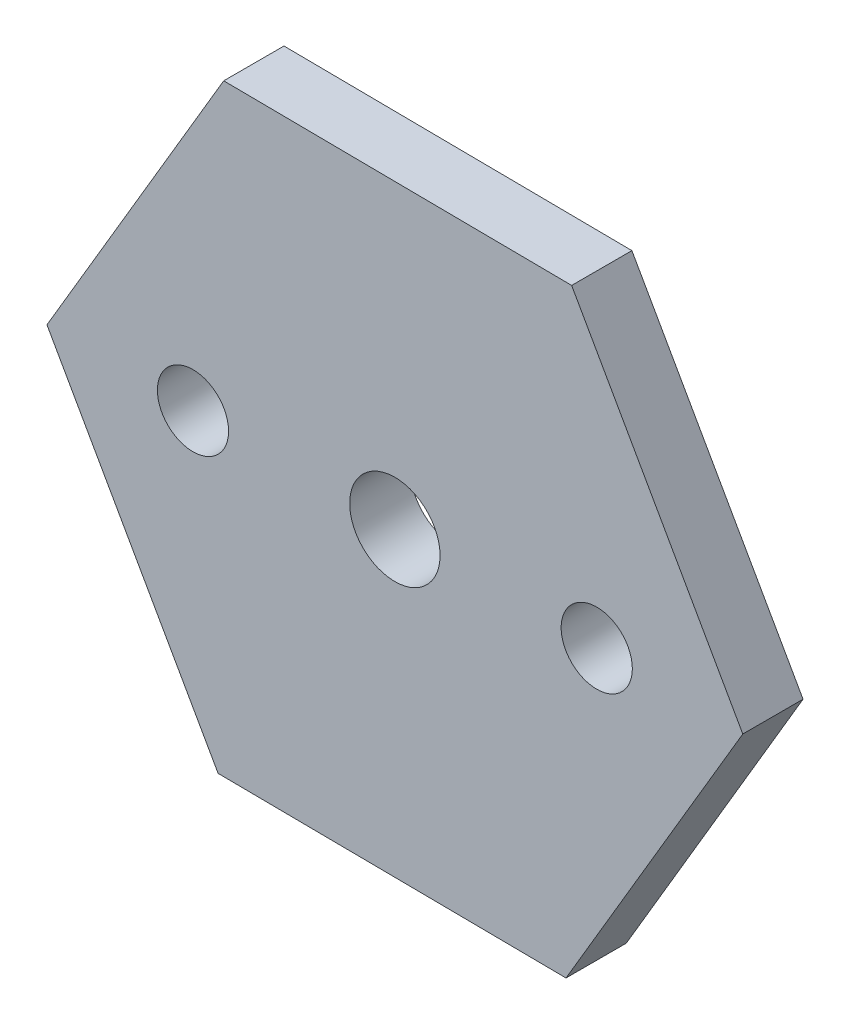
from build123d import *

# Parameters (mm, degrees)
SKETCH1_R           = 1.5
SKETCH1_R_2         = 1.905
BOSS_EXTRUDE1_DEPTH = 2.54


with BuildPart() as part:
    # Sketch1 → Boss-Extrude1 (new body)
    with BuildSketch(Plane.XY):
        Polygon((-7.213493432, 12.767883374), (-14.66405807, 0.136873125), (-7.450564639, -12.631010249), (7.213493432, -12.767883374), (14.66405807, -0.136873125), (7.450564639, 12.631010249), align=None)
        with Locations((-8.509, 0.079422314)):
            Circle(SKETCH1_R, mode=Mode.SUBTRACT)
        with Locations((8.509, -0.079422314)):
            Circle(SKETCH1_R, mode=Mode.SUBTRACT)
        Circle(SKETCH1_R_2, mode=Mode.SUBTRACT)
    extrude(amount=BOSS_EXTRUDE1_DEPTH)


solid = part.part
